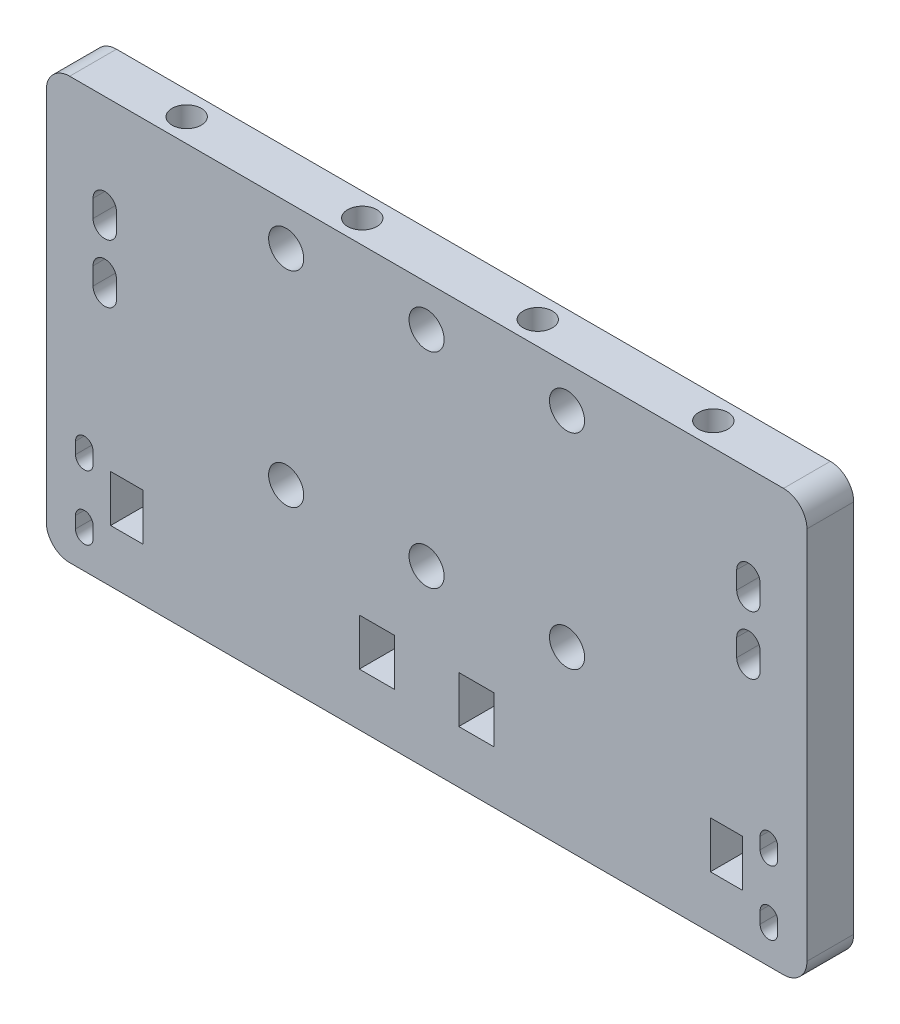
from build123d import *

# Parameters (mm, degrees)
BOSS_EXTRU_1_DEPTH       = 8
ESQUISSE2_W              = 5.5
ESQUISSE2_H              = 8
ESQUISSE2_W_2            = 6
ENL_V_MAT_EXTRU_1_DEPTH  = 10
ESQUISSE9_R              = 2.5
ENL_V_MAT_EXTRU_6_DEPTH  = 20
ESQUISSE10_R             = 3
ENL_V_MAT_EXTRU_7_DEPTH  = 148.799418472
ENL_V_MAT_EXTRU_12_DEPTH = 148.799418472
ENL_V_MAT_EXTRU_13_DEPTH = 148.799418472


with BuildPart() as part:
    # Esquisse1 → Boss.-Extru.1 (new body)
    with BuildSketch(Plane.XY):
        with BuildLine():
            Line((4, -2.138221462), (126, -2.138221462))
            ThreePointArc((126, -2.138221462), (128.828427125, -0.966648586), (130, 1.861778538))
            Line((130, 1.861778538), (130, 17.861778538))
            Line((130, 17.861778538), (130, 65.861778538))
            ThreePointArc((130, 65.861778538), (128.828427125, 68.690205663), (126, 69.861778538))
            Line((126, 69.861778538), (4, 69.861778538))
            ThreePointArc((4, 69.861778538), (1.171572875, 68.690205663), (0, 65.861778538))
            Line((0, 65.861778538), (0, 17.861778538))
            Line((0, 17.861778538), (0, 1.861778538))
            ThreePointArc((0, 1.861778538), (1.171572875, -0.966648586), (4, -2.138221462))
        make_face()
    extrude(amount=BOSS_EXTRU_1_DEPTH)

    # Esquisse2 → Enlèv. mat.-Extru.1 (cut)
    with BuildSketch(Plane.XY.offset(8)):
        with Locations((13.75, 10.861778538)):
            Rectangle(ESQUISSE2_W, ESQUISSE2_H)
        with Locations((56.5, 10.861778538)):
            Rectangle(ESQUISSE2_W_2, ESQUISSE2_H)
        with Locations((73.5, 10.861778538)):
            Rectangle(ESQUISSE2_W_2, ESQUISSE2_H)
        with Locations((116.25, 10.861778538)):
            Rectangle(ESQUISSE2_W, ESQUISSE2_H)
    extrude(amount=-ENL_V_MAT_EXTRU_1_DEPTH, mode=Mode.SUBTRACT)

    # Esquisse9 → Enlèv. mat.-Extru.6 (cut)
    with BuildSketch(Plane(origin=(0, 69.861778538, 0), x_dir=(1, 0, 0), z_dir=(0, 1, 0))):
        with Locations(Location((20, -4, 0), (0, 0, 270))):
            Circle(ESQUISSE9_R)
        with Locations(Location((50, -4, 0), (0, 0, 270))):
            Circle(ESQUISSE9_R)
        with Locations(Location((80, -4, 0), (0, 0, 270))):
            Circle(ESQUISSE9_R)
        with Locations(Location((110, -4, 0), (0, 0, 270))):
            Circle(ESQUISSE9_R)
    extrude(amount=-ENL_V_MAT_EXTRU_6_DEPTH, mode=Mode.SUBTRACT)

    # Esquisse10 → Enlèv. mat.-Extru.7 (cut, through all)
    with BuildSketch(Plane.XY.offset(8)):
        with Locations((41, 62.861778538)):
            Circle(ESQUISSE10_R)
        with Locations(Location((41, 27.861778538, 0), (0, 0, 180))):
            Circle(ESQUISSE10_R)
        with Locations((65, 62.861778538)):
            Circle(ESQUISSE10_R)
        with Locations(Location((65, 27.861778538, 0), (0, 0, 180))):
            Circle(ESQUISSE10_R)
        with Locations((89, 62.861778538)):
            Circle(ESQUISSE10_R)
        with Locations(Location((89, 27.861778538, 0), (0, 0, 180))):
            Circle(ESQUISSE10_R)
    extrude(amount=-ENL_V_MAT_EXTRU_7_DEPTH, mode=Mode.SUBTRACT)

    # Esquisse18 → Enlèv. mat.-Extru.12 (cut, through all)
    with BuildSketch(Plane(origin=(0, 0, 0), x_dir=(-1, 0, 0), z_dir=(0, 0, -1))):
        with BuildLine():
            Line((-125, 3.361778538), (-125, 5.361778538))
            ThreePointArc((-125, 5.361778538), (-123.5, 6.861778538), (-122, 5.361778538))
            Line((-122, 5.361778538), (-122, 3.361778538))
            ThreePointArc((-122, 3.361778538), (-123.5, 1.861778538), (-125, 3.361778538))
        make_face()
        with BuildLine():
            Line((-125, 16.361778538), (-125, 14.361778538))
            ThreePointArc((-125, 14.361778538), (-123.5, 12.861778538), (-122, 14.361778538))
            Line((-122, 14.361778538), (-122, 16.361778538))
            ThreePointArc((-122, 16.361778538), (-123.5, 17.861778538), (-125, 16.361778538))
        make_face()
        with BuildLine():
            Line((-8, 3.361778538), (-8, 5.361778538))
            ThreePointArc((-8, 5.361778538), (-6.5, 6.861778538), (-5, 5.361778538))
            Line((-5, 5.361778538), (-5, 3.361778538))
            ThreePointArc((-5, 3.361778538), (-6.5, 1.861778538), (-8, 3.361778538))
        make_face()
        with BuildLine():
            Line((-8, 16.361778538), (-8, 14.361778538))
            ThreePointArc((-8, 14.361778538), (-6.5, 12.861778538), (-5, 14.361778538))
            Line((-5, 14.361778538), (-5, 16.361778538))
            ThreePointArc((-5, 16.361778538), (-6.5, 17.861778538), (-8, 16.361778538))
        make_face()
    extrude(amount=-ENL_V_MAT_EXTRU_12_DEPTH, mode=Mode.SUBTRACT)

    # Esquisse21 → Enlèv. mat.-Extru.13 (cut, through all)
    with BuildSketch(Plane(origin=(0, 0, 0), x_dir=(-1, 0, 0), z_dir=(0, 0, -1))):
        with BuildLine():
            Line((-122, 40.808238571), (-122, 43.808238571))
            ThreePointArc((-122, 43.808238571), (-120, 45.808238571), (-118, 43.808238571))
            Line((-118, 43.808238571), (-118, 40.808238571))
            ThreePointArc((-118, 40.808238571), (-120, 38.808238571), (-122, 40.808238571))
        make_face()
        with BuildLine():
            Line((-122, 53.808238571), (-122, 50.808238571))
            ThreePointArc((-122, 50.808238571), (-120, 48.808238571), (-118, 50.808238571))
            Line((-118, 50.808238571), (-118, 53.808238571))
            ThreePointArc((-118, 53.808238571), (-120, 55.808238571), (-122, 53.808238571))
        make_face()
        with BuildLine():
            Line((-12, 40.808238571), (-12, 43.808238571))
            ThreePointArc((-12, 43.808238571), (-10, 45.808238571), (-8, 43.808238571))
            Line((-8, 43.808238571), (-8, 40.808238571))
            ThreePointArc((-8, 40.808238571), (-10, 38.808238571), (-12, 40.808238571))
        make_face()
        with BuildLine():
            Line((-12, 53.808238571), (-12, 50.808238571))
            ThreePointArc((-12, 50.808238571), (-10, 48.808238571), (-8, 50.808238571))
            Line((-8, 50.808238571), (-8, 53.808238571))
            ThreePointArc((-8, 53.808238571), (-10, 55.808238571), (-12, 53.808238571))
        make_face()
    extrude(amount=-ENL_V_MAT_EXTRU_13_DEPTH, mode=Mode.SUBTRACT)


solid = part.part
